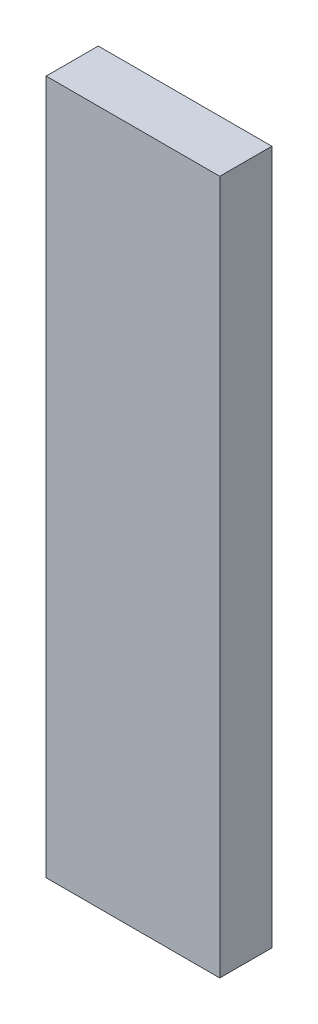
from build123d import *

# Parameters (mm, degrees)
BOSS_EXTRUDE1_DEPTH = 4.5


with BuildPart() as part:
    # Sketch1 → Boss-Extrude1 (new body)
    with BuildSketch(Plane.XY):
        Polygon((7.5, 0), (-7.5, 0), (-7.5, 60), (0, 60), (7.5, 60), align=None)
    extrude(amount=BOSS_EXTRUDE1_DEPTH)


solid = part.part
